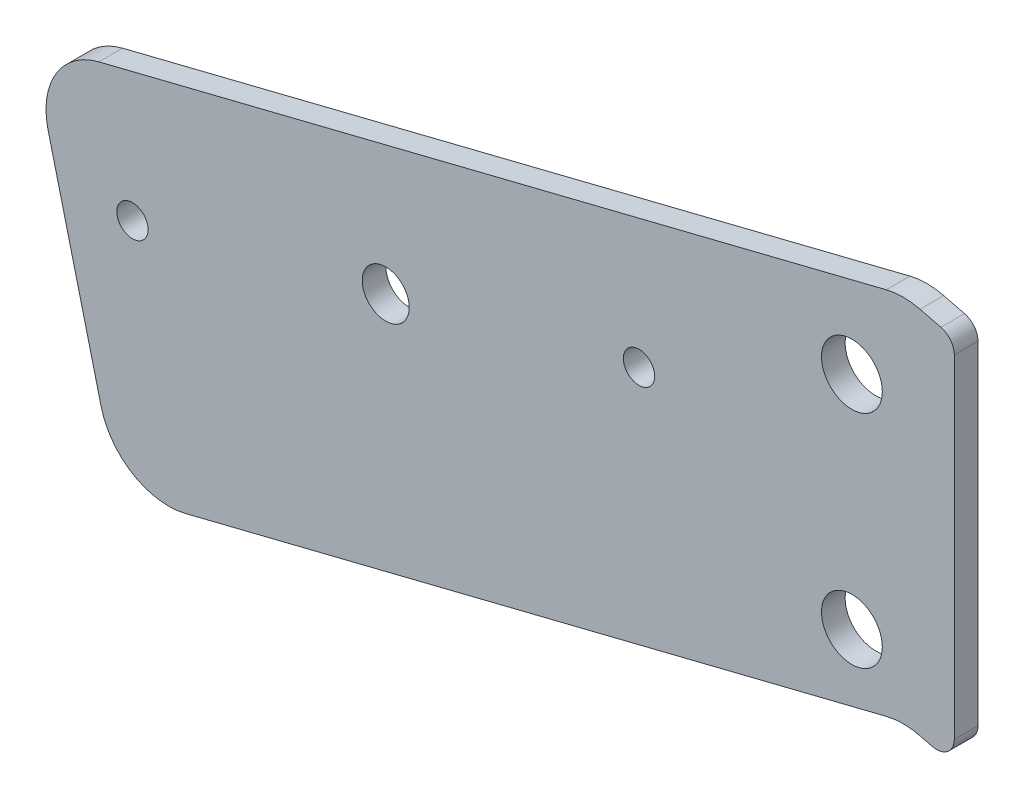
from build123d import *

# Parameters (mm, degrees)
BOSS_EXTRUDE1_DEPTH             = 3.4036
F_1_4_CLEARANCE_HOLE1_D         = 6.7564
M4_CLEARANCE_HOLE1_D            = 4.5
HOLE_FOR_1_4_300_SC_NUTS_SP_1_D = 8.7376


with BuildPart() as part:
    # Sketch1 → Boss-Extrude1 (new body)
    with BuildSketch(Plane.XY):
        with BuildLine():
            Line((7.348321245, -20.048772414), (7.348321245, -67.889857088))
            ThreePointArc((7.348321245, -67.889857088), (6.372101393, -69.891404403), (4.193839631, -70.354408233))
            Line((4.193839631, -70.354408233), (2.419218956, -69.911945605))
            ThreePointArc((2.419218956, -69.911945605), (0, -69.614902867), (-2.419218956, -69.911945605))
            Line((-2.419218956, -69.911945605), (-103.101990119, -95.014979859))
            ThreePointArc((-103.101990119, -95.014979859), (-110.671589825, -93.883695604), (-115.224166338, -87.731241553))
            Line((-115.224166338, -87.731241553), (-122.84470605, -57.166926175))
            ThreePointArc((-122.84470605, -57.166926175), (-121.713421794, -49.59732647), (-115.560967743, -45.044749956))
            Line((-115.560967743, -45.044749956), (-2.419218956, -16.835343693))
            ThreePointArc((-2.419218956, -16.835343693), (0, -16.538300956), (2.419218956, -16.835343693))
            Line((2.419218956, -16.835343693), (5.42280286, -17.584221269))
            ThreePointArc((5.42280286, -17.584221269), (6.80986856, -18.484992267), (7.348321245, -20.048772414))
        make_face()
    extrude(amount=-BOSS_EXTRUDE1_DEPTH)

    # 1/4 Clearance Hole1 (through all)
    with Locations(Plane.XY):
        with Locations((-74.335136024, -53.317040996)):
            Hole(F_1_4_CLEARANCE_HOLE1_D / 2)

    # M4 Clearance Hole1 (through all)
    with Locations(Plane.XY):
        with Locations((-110.721225759, -62.389112081), (-37.949046288, -44.244969911)):
            Hole(M4_CLEARANCE_HOLE1_D / 2)

    # Hole for 1/4 300® SC Nuts (SP)1 (through all)
    with Locations(Plane.XY):
        with Locations((-7.366, -61.569560235), (-7.366, -29.819560235)):
            Hole(HOLE_FOR_1_4_300_SC_NUTS_SP_1_D / 2)


solid = part.part
